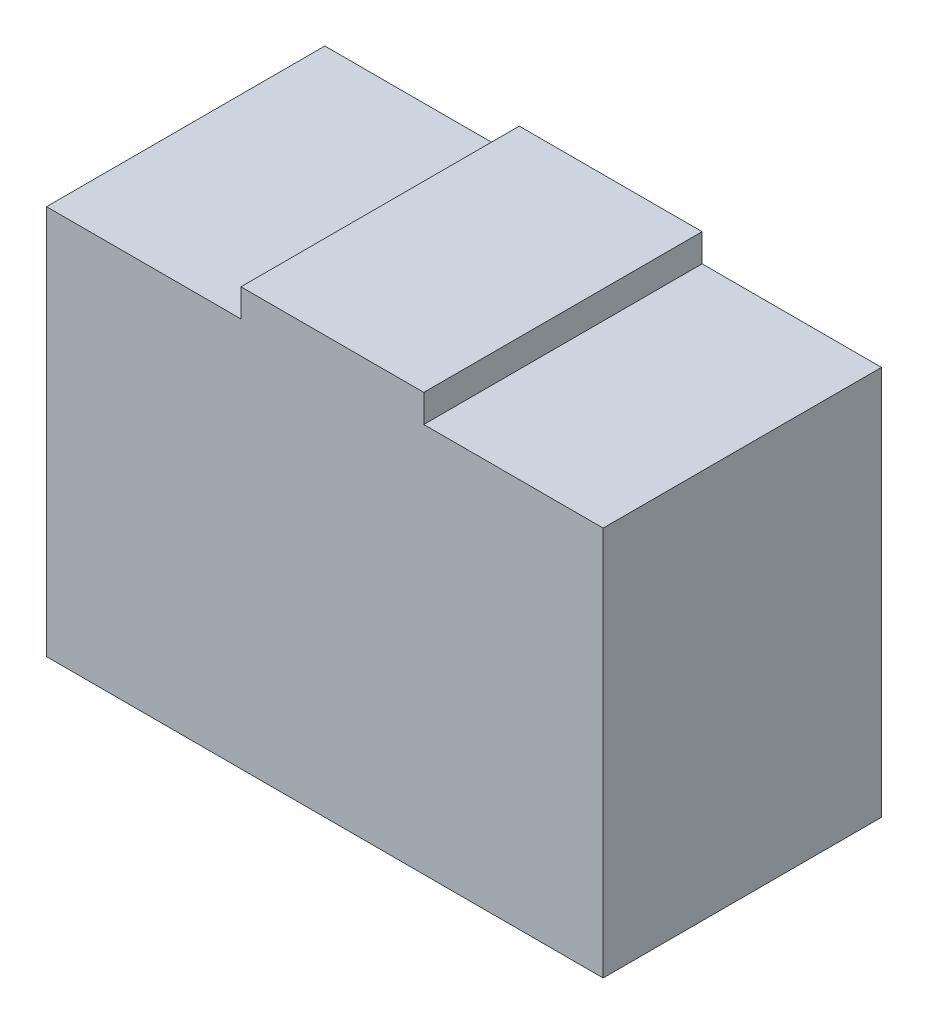
from build123d import *

# Parameters (mm, degrees)
SKETCH_1_W      = 1
SKETCH_1_H      = 0.7
EXTRUDE_1_DEPTH = 0.5
SKETCH_4_W      = 0.328484595
SKETCH_4_H      = 0.5
EXTRUDE_2_DEPTH = 0.05


with BuildPart() as part:
    # 草图1 → 凸台-拉伸1 (new body)
    with BuildSketch(Plane.XY):
        with Locations((-0.464285714, 0.654464286)):
            Rectangle(SKETCH_1_W, SKETCH_1_H)
    extrude(amount=EXTRUDE_1_DEPTH)

    # 草图4 → 凸台-拉伸2 (add)
    with BuildSketch(Plane(origin=(0, 1.004464286, 0), x_dir=(1, 0, 0), z_dir=(0, 1, 0))):
        with Locations((-0.450775928, -0.25)):
            Rectangle(SKETCH_4_W, SKETCH_4_H)
    extrude(amount=EXTRUDE_2_DEPTH)


solid = part.part
